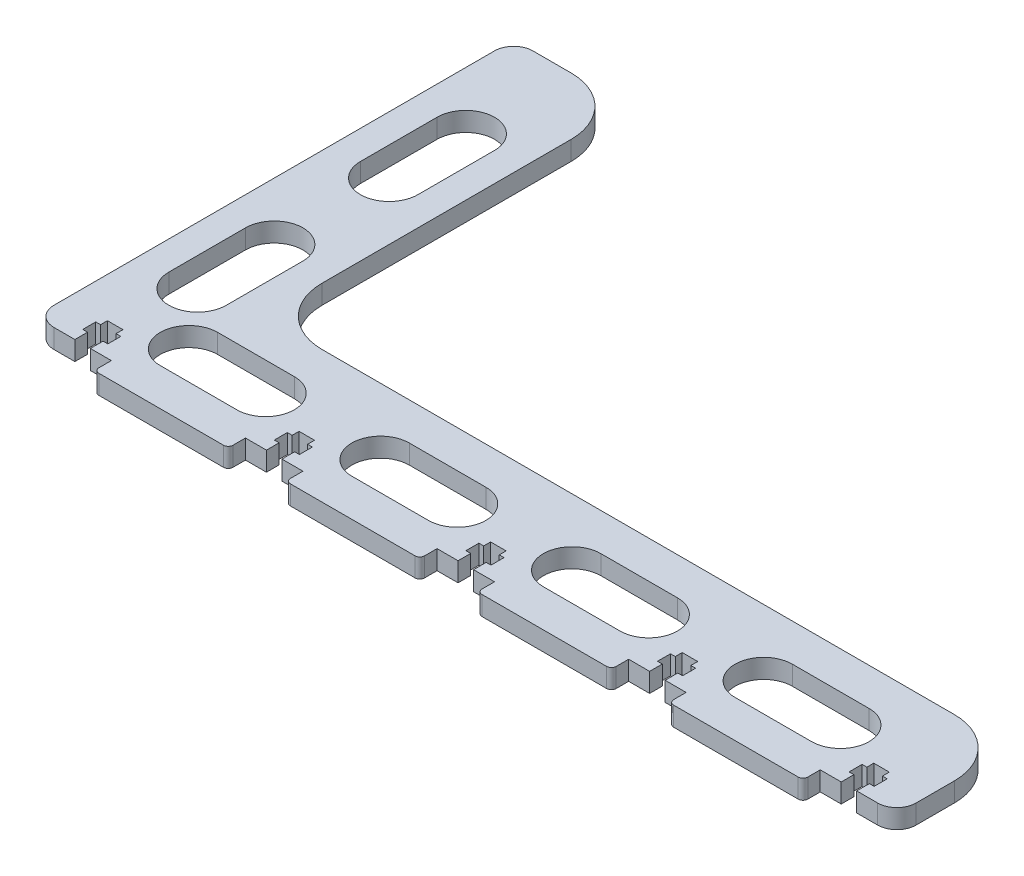
from build123d import *

# Parameters (mm, degrees)
SKETCH1_W              = 450
SKETCH1_H              = 450
BOSS_EXTRUDE1_DEPTH    = 10
SKETCH2_W              = 8.1
SKETCH2_H              = 27
SKETCH2_W_2            = 13.1
SKETCH2_H_2            = 6.8
CUT_EXTRUDE1_DEPTH     = 637.474665639
LPATTERN1_COUNT        = 3
LPATTERN1_PITCH        = 100
LPATTERN1_COL_COUNT    = 3
LPATTERN1_COL_PITCH    = 100
SKETCH3_W              = 70
SKETCH3_H              = 9
BOSS_EXTRUDE2_DEPTH    = 10
FILLET1_R              = 2.5
LPATTERN2_COUNT        = 4
LPATTERN2_PITCH        = 100
FILLET1_OF_LPATTERN2_R = 2.5
SKETCH4_W              = 390
SKETCH4_H              = 390
SKETCH4_W_2            = 60
SKETCH4_H_2            = 200
CUT_EXTRUDE2_DEPTH     = 637.474665639
CUT_EXTRUDE3_DEPTH     = 515.878626474
FILLET2_R              = 10
FILLET3_R              = 30


with BuildPart() as part:
    # Sketch1 → Boss-Extrude1 (new body)
    with BuildSketch(Plane(origin=(0, 0, 0), x_dir=(1, 0, 0), z_dir=(0, 1, 0))):
        with Locations((225, 225)):
            Rectangle(SKETCH1_W, SKETCH1_H)
    extrude(amount=BOSS_EXTRUDE1_DEPTH)

    # Sketch2 → Cut-Extrude1 (cut, through all)
    with BuildSketch(Plane(origin=(0, 10, 0), x_dir=(1, 0, 0), z_dir=(0, 1, 0))):
        with Locations((225, 3.5)):
            Rectangle(SKETCH2_W, SKETCH2_H)
        with Locations((225, 10)):
            Rectangle(SKETCH2_W_2, SKETCH2_H_2)
    cut_extrude1 = extrude(amount=-CUT_EXTRUDE1_DEPTH, mode=Mode.SUBTRACT)

    # LPattern1: Cut-Extrude1 ×3
    with Locations(*[(-i * LPATTERN1_PITCH, 0, 0) for i in range(1, LPATTERN1_COUNT)]):
        add(cut_extrude1, mode=Mode.SUBTRACT)

    # LPattern1 col: Cut-Extrude1 ×3
    with Locations(*[(i * LPATTERN1_COL_PITCH, 0, 0) for i in range(1, LPATTERN1_COL_COUNT)]):
        add(cut_extrude1, mode=Mode.SUBTRACT)

    # Sketch3 → Boss-Extrude2 (add)
    with BuildSketch(Plane(origin=(0, 10, 0), x_dir=(1, 0, 0), z_dir=(0, 1, 0))):
        with Locations((75, -4.5)):
            Rectangle(SKETCH3_W, SKETCH3_H)
    boss_extrude2 = extrude(amount=-BOSS_EXTRUDE2_DEPTH)

    # Fillet1
    fillet1_edges = [part.edges().sort_by_distance(p)[0] for p in [
        (110, 5, 9),
        (40, 5, 9),
    ]]
    fillet(fillet1_edges, radius=FILLET1_R)

    # LPattern2: Boss-Extrude2 ×4
    with Locations(*[(i * LPATTERN2_PITCH, 0, 0) for i in range(1, LPATTERN2_COUNT)]):
        add(boss_extrude2)

    # Fillet1 of LPattern2
    fillet1_of_lpattern2_edges = [part.edges().sort_by_distance(p)[0] for p in [
        (210, 5, 9),
        (140, 5, 9),
        (310, 5, 9),
        (240, 5, 9),
        (410, 5, 9),
        (340, 5, 9),
    ]]
    fillet(fillet1_of_lpattern2_edges, radius=FILLET1_OF_LPATTERN2_R)

    # Sketch4 → Cut-Extrude2 (cut, through all)
    with BuildSketch(Plane(origin=(0, 10, 0), x_dir=(1, 0, 0), z_dir=(0, 1, 0))):
        with Locations((255, 255)):
            Rectangle(SKETCH4_W, SKETCH4_H)
        with Locations((30, 350)):
            Rectangle(SKETCH4_W_2, SKETCH4_H_2)
    extrude(amount=-CUT_EXTRUDE2_DEPTH, mode=Mode.SUBTRACT)

    # Sketch5 → Cut-Extrude3 (cut, through all)
    with BuildSketch(Plane(origin=(0, 10, 0), x_dir=(1, 0, 0), z_dir=(0, 1, 0))):
        with BuildLine():
            Line((55, 40.5), (95, 40.5))
            ThreePointArc((95, 40.5), (110, 25.5), (95, 10.5))
            Line((95, 10.5), (55, 10.5))
            ThreePointArc((55, 10.5), (40, 25.5), (55, 40.5))
        make_face()
        with BuildLine():
            Line((155, 40.5), (195, 40.5))
            ThreePointArc((195, 40.5), (210, 25.5), (195, 10.5))
            Line((195, 10.5), (155, 10.5))
            ThreePointArc((155, 10.5), (140, 25.5), (155, 40.5))
        make_face()
        with BuildLine():
            Line((255, 40.5), (295, 40.5))
            ThreePointArc((295, 40.5), (310, 25.5), (295, 10.5))
            Line((295, 10.5), (255, 10.5))
            ThreePointArc((255, 10.5), (240, 25.5), (255, 40.5))
        make_face()
        with BuildLine():
            Line((355, 40.5), (395, 40.5))
            ThreePointArc((395, 40.5), (410, 25.5), (395, 10.5))
            Line((395, 10.5), (355, 10.5))
            ThreePointArc((355, 10.5), (340, 25.5), (355, 40.5))
        make_face()
        with BuildLine():
            Line((15, 55), (15, 95))
            ThreePointArc((15, 95), (30, 110), (45, 95))
            Line((45, 95), (45, 55))
            ThreePointArc((45, 55), (30, 40), (15, 55))
        make_face()
        with BuildLine():
            Line((45, 195), (45, 155))
            ThreePointArc((45, 155), (30, 140), (15, 155))
            Line((15, 155), (15, 195))
            ThreePointArc((15, 195), (30, 210), (45, 195))
        make_face()
    extrude(amount=-CUT_EXTRUDE3_DEPTH, mode=Mode.SUBTRACT)

    # Fillet2
    fillet2_edges = [part.edges().sort_by_distance(p)[0] for p in [
        (0, 5, -250),
        (450, 5, 0),
        (0, 5, 0),
    ]]
    fillet(fillet2_edges, radius=FILLET2_R)

    # Fillet3
    fillet3_edges = [part.edges().sort_by_distance(p)[0] for p in [
        (450, 5, -60),
        (60, 5, -60),
        (60, 5, -250),
    ]]
    fillet(fillet3_edges, radius=FILLET3_R)


solid = part.part
